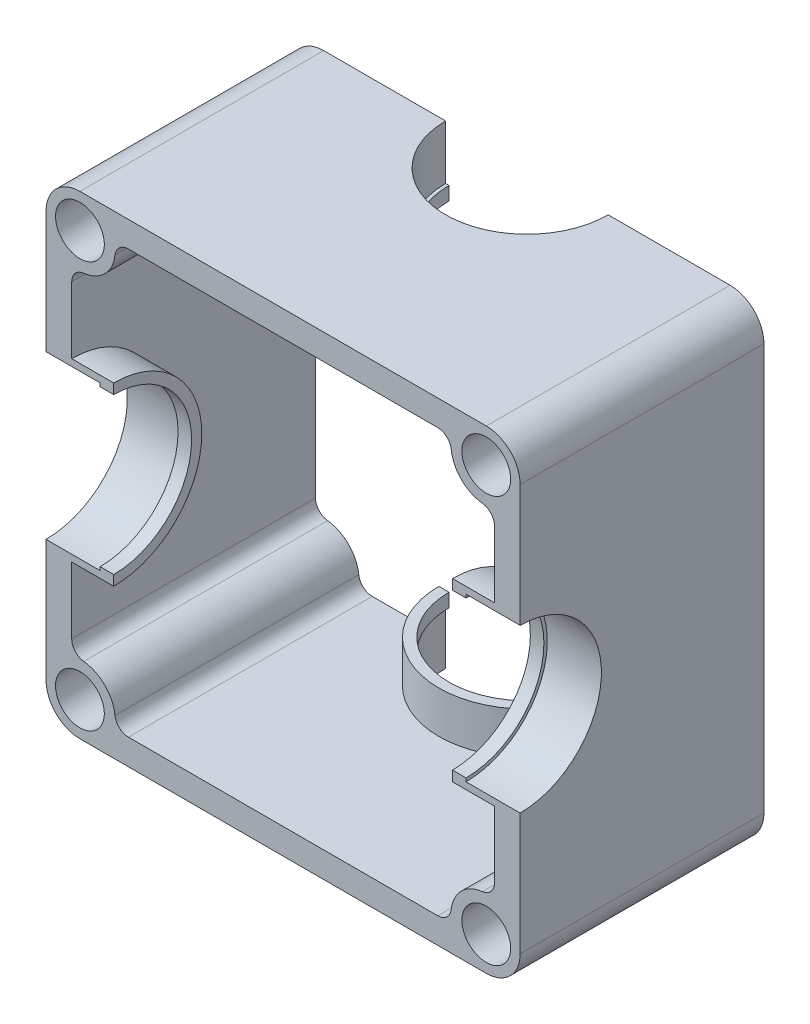
from build123d import *

# Parameters (mm, degrees)
SKETCH_1_R          = 1.8000000000000025
SKETCH_1_R_2        = 1.8000000000000043
SKETCH_1_R_3        = 1.8000000000000005
SKETCH_1_R_4        = 1.8000000000000007
EXTRUDE_1_DEPTH     = 42
SKETCH_2_R          = 6.000000000000001
CUT_EXTRUDE_1_DEPTH = 58.404268133998535
SKETCH_3_R          = 6.000000000000002
CUT_EXTRUDE_2_DEPTH = 58.404268133998535
SKETCH_5_W          = 12
SKETCH_5_H          = 15.000000000000005
SKETCH_5_H_2        = 15.000000000000002
CUT_EXTRUDE_3_DEPTH = 58.404268133998535
EXTRUDE_2_DEPTH     = 2.1
EXTRUDE_3_DEPTH     = 1
EXTRUDE_START       = 2.1
EXTRUDE_4_DEPTH     = 2.1
EXTRUDE_START_2     = 1
EXTRUDE_5_DEPTH     = 1


with BuildPart() as part:
    # 草图1 → 凸台-拉伸1 (new body)
    with BuildSketch(Plane(origin=(0, 0, 0), x_dir=(-1, 0, 0), z_dir=(0, 0, 1))):
        with BuildLine():
            Line((-17.499999999999996, 15), (-17.499999999999996, -15.000000000000007))
            ThreePointArc((-17.499999999999996, -15.000000000000007), (-16.767766952966365, -16.767766952966372), (-15, -17.500000000000007))
            Line((-15, -17.500000000000007), (15.000000000000004, -17.500000000000007))
            ThreePointArc((15.000000000000004, -17.500000000000007), (16.76776695296637, -16.767766952966376), (17.5, -15.00000000000001))
            Line((17.5, -15.00000000000001), (17.5, 14.999999999999996))
            ThreePointArc((17.5, 14.999999999999996), (16.76776695296637, 16.76776695296636), (15.000000000000004, 17.499999999999996))
            Line((15.000000000000004, 17.499999999999996), (-15, 17.499999999999996))
            ThreePointArc((-15, 17.499999999999996), (-16.767766952966365, 16.767766952966365), (-17.499999999999996, 15))
        make_face()
        with Locations((-15.000000000000004, -15.00000000000001)):
            Circle(SKETCH_1_R, mode=Mode.SUBTRACT)
        with Locations((15.000000000000004, -15.00000000000001)):
            Circle(SKETCH_1_R_2, mode=Mode.SUBTRACT)
        with Locations((15.000000000000004, 14.999999999999996)):
            Circle(SKETCH_1_R_3, mode=Mode.SUBTRACT)
        with Locations((-15, 15)):
            Circle(SKETCH_1_R_4, mode=Mode.SUBTRACT)
        with BuildLine():
            Line((15.604722413530899, -11.417049414734192), (15.604722413530899, 11.41704941481964))
            ThreePointArc((15.604722413530899, 11.41704941481964), (15.349600753639777, 12.084241863325458), (14.714404940145743, 12.41098197902667))
            ThreePointArc((14.714404940145743, 12.41098197902667), (13.158183898644735, 13.15818233801838), (12.410982220986185, 14.714402746377065))
            ThreePointArc((12.410982220986185, 14.714402746377065), (12.084242685294747, 15.349600017363324), (11.417049414775391, 15.604722413530212))
            Line((11.417049414775391, 15.604722413530212), (-11.417049414778536, 15.604722413530212))
            ThreePointArc((-11.417049414778536, 15.604722413530212), (-12.084241863278942, 15.349600753643644), (-12.410981978984013, 14.714404940159108))
            ThreePointArc((-12.410981978984013, 14.714404940159108), (-13.158182337972896, 13.158183898648431), (-14.714402746337697, 12.41098222098531))
            ThreePointArc((-14.714402746337697, 12.41098222098531), (-15.34960001732269, 12.084242685293246), (-15.604722413489107, 11.41704941477461))
            Line((-15.604722413489107, 11.41704941477461), (-15.604722413489107, -11.417049414779225))
            ThreePointArc((-15.604722413489107, -11.417049414779225), (-15.349600753597985, -12.084241863285039), (-14.714404940103952, -12.410981978986248))
            ThreePointArc((-14.714404940103952, -12.410981978986248), (-13.158183898602942, -13.158182337977962), (-12.410982220944396, -14.714402746336651))
            ThreePointArc((-12.410982220944396, -14.714402746336651), (-12.084242685252958, -15.34960001732291), (-11.417049414733604, -15.604722413489796))
            Line((-11.417049414733604, -15.604722413489796), (11.417049414820326, -15.604722413489796))
            ThreePointArc((11.417049414820326, -15.604722413489796), (12.084241863320731, -15.349600753603227), (12.410981979025802, -14.714404940118692))
            ThreePointArc((12.410981979025802, -14.714404940118692), (13.158182338014687, -13.158183898608014), (14.71440274637949, -12.410982220944893))
            ThreePointArc((14.71440274637949, -12.410982220944893), (15.34960001736448, -12.084242685252828), (15.604722413530899, -11.417049414734192))
        make_face(mode=Mode.SUBTRACT)
    extrude(amount=EXTRUDE_1_DEPTH)

    # 草图2 → 切除-拉伸1 (cut, through all)
    with BuildSketch(Plane(origin=(0, 17.500000000000007, 0), x_dir=(1, 0, 0), z_dir=(0, 1, 0))):
        with Locations(Location((0, -11.999999999999998, 0), (0, 0, 270))):
            Circle(SKETCH_2_R)
    extrude(amount=-CUT_EXTRUDE_1_DEPTH, mode=Mode.SUBTRACT)

    # 草图3 → 切除-拉伸2 (cut, through all)
    with BuildSketch(Plane.ZY.offset(17.5)):
        with Locations((30, 0)):
            Circle(SKETCH_3_R)
    extrude(amount=-CUT_EXTRUDE_2_DEPTH, mode=Mode.SUBTRACT)

    # 草图5 → 切除-拉伸3 (cut, through all)
    with BuildSketch(Plane(origin=(17.499999999999996, 0, 0), x_dir=(0, 0, -1), z_dir=(1, 0, 0))):
        Polygon((-30, -24.974265818952347), (-30, -15), (-42, -15), (-42, 15.000000000000007), (-30, 15.000000000000007), (-30, 23.87950348168345), (-47.41212790980853, 25.238249525472156), (-47.41212790980853, -24.974265818952347), align=None)
        with BuildLine():
            Line((-42, -15), (-30, -15))
            Line((-30, -15), (-30, -6.000000000000003))
            ThreePointArc((-29.999999999999925, -6.000000000000003), (-36, -1.93e-15), (-29.999999999999932, 6.000000000000003))
            Line((-30, 6.000000000000003), (-30, 15.000000000000007))
            Line((-30, 15.000000000000007), (-42, 15.000000000000007))
            Line((-42, 15.000000000000007), (-42, -15))
        make_face()
        with Locations((-6, 7.500000000000003)):
            Rectangle(SKETCH_5_W, SKETCH_5_H)
        Polygon((0, 15.000000000000007), (0, 0), (0, -15), (-12, -15), (-12, -24.974265818952347), (12.116605042765016, -24.974265818952347), (12.116605042765016, 23.87950348168345), (-12, 23.87950348168345), (-12, 15.000000000000007), align=None)
        with Locations((-6, -7.500000000000001)):
            Rectangle(SKETCH_5_W, SKETCH_5_H_2)
    extrude(amount=-CUT_EXTRUDE_3_DEPTH, mode=Mode.SUBTRACT)

    # 草图6 → 凸台-拉伸2 (add)
    with BuildSketch(Plane(origin=(0, 15.604722413489796, 0), x_dir=(-1, 0, 0), z_dir=(0, -1, 0))):
        with BuildLine():
            Line((-6.000000000000001, -11.999999999999998), (-6.500000000000001, -11.999999999999998))
            ThreePointArc((-6.500000000000001, -11.999999999999998), (-1.19e-15, -18.5), (6.500000000000001, -11.999999999999998))
            Line((6.500000000000001, -11.999999999999998), (6.000000000000001, -11.999999999999998))
            ThreePointArc((6.000000000000001, -11.999999999999998), (-1.1e-15, -18), (-6.000000000000001, -11.999999999999998))
        make_face()
    extrude_2 = extrude(amount=EXTRUDE_2_DEPTH)

    # 草图7 → 凸台-拉伸3 (add)
    with BuildSketch(Plane(origin=(0, 13.504722413489795, 0), x_dir=(-1, 0, 0), z_dir=(0, -1, 0))):
        with BuildLine():
            Line((-6.500000000000002, -11.999999999999998), (-5.750000000000001, -11.999999999999998))
            ThreePointArc((-5.750000000000001, -11.999999999999998), (-1.06e-15, -17.75), (5.750000000000001, -11.999999999999998))
            Line((5.750000000000001, -11.999999999999998), (6.500000000000002, -11.999999999999998))
            ThreePointArc((6.500000000000002, -11.999999999999998), (-1.19e-15, -18.5), (-6.500000000000002, -11.999999999999998))
        make_face()
    extrude_3 = extrude(amount=EXTRUDE_3_DEPTH)

    # 镜向1: 凸台-拉伸2, 凸台-拉伸3 across plane
    add(extrude_2.mirror(Plane(origin=(0, 0, 0), x_dir=(0, 0, 1), z_dir=(0, -1, 0))))
    add(extrude_3.mirror(Plane(origin=(0, 0, 0), x_dir=(0, 0, 1), z_dir=(0, -1, 0))))

    # 草图8 → 凸台-拉伸4 (add)
    with BuildSketch(Plane.ZY.offset(-15.604722413489107).offset(EXTRUDE_START)):
        with BuildLine():
            Line((30, -6.500000000000001), (30, -6.000000000000003))
            ThreePointArc((30, -6.000000000000003), (23.999999999999996, 7.3e-16), (30, 6.000000000000003))
            Line((30, 6.000000000000003), (30, 6.500000000000001))
            ThreePointArc((30, 6.500000000000001), (23.5, 8e-16), (30, -6.500000000000001))
        make_face()
    extrude_4 = extrude(amount=-EXTRUDE_4_DEPTH)

    # 草图9 → 凸台-拉伸5 (add)
    with BuildSketch(Plane.ZY.offset(-13.504722413489107).offset(EXTRUDE_START_2)):
        with BuildLine():
            Line((30, -6.500000000000001), (30, -5.750000000000003))
            ThreePointArc((30, -5.750000000000003), (24.249999999999996, 7e-16), (30, 5.750000000000003))
            Line((30, 5.750000000000003), (30, 6.500000000000001))
            ThreePointArc((30, 6.500000000000001), (23.5, 8e-16), (30, -6.500000000000001))
        make_face()
    extrude_5 = extrude(amount=-EXTRUDE_5_DEPTH)

    # 镜向2: 凸台-拉伸4, 凸台-拉伸5 across plane
    add(extrude_4.mirror(Plane.ZY))
    add(extrude_5.mirror(Plane.ZY))


solid = part.part
